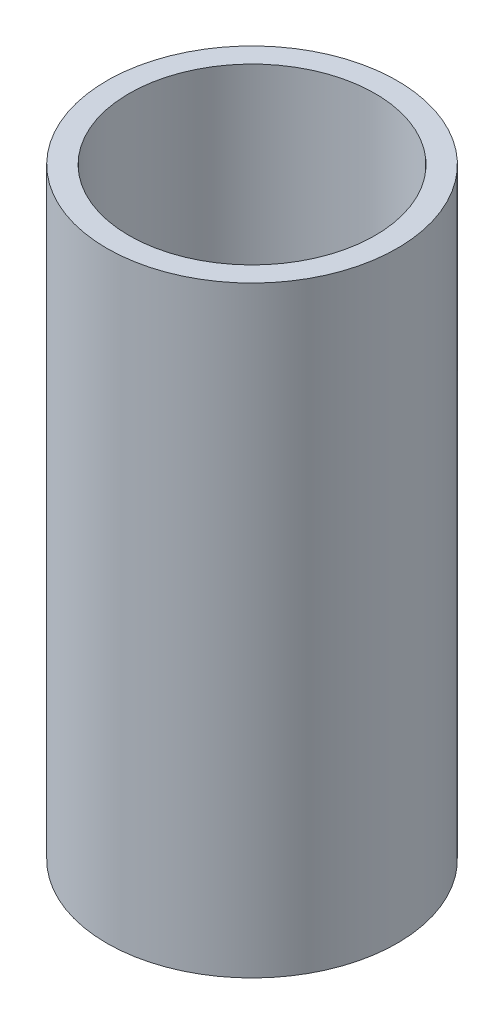
from build123d import *

# Parameters (mm, degrees)
SKETCH1_R           = 24.13
SKETCH1_R_2         = 20.445
BOSS_EXTRUDE1_DEPTH = 100


with BuildPart() as part:
    # Sketch1 → Boss-Extrude1 (new body)
    with BuildSketch(Plane(origin=(0, 0, 0), x_dir=(1, 0, 0), z_dir=(0, 1, 0))):
        with Locations(Location((0, 0, 0), (0, 0, 270))):
            Circle(SKETCH1_R)
        with Locations(Location((0, 0, 0), (0, 0, 270))):
            Circle(SKETCH1_R_2, mode=Mode.SUBTRACT)
    extrude(amount=BOSS_EXTRUDE1_DEPTH)


solid = part.part
